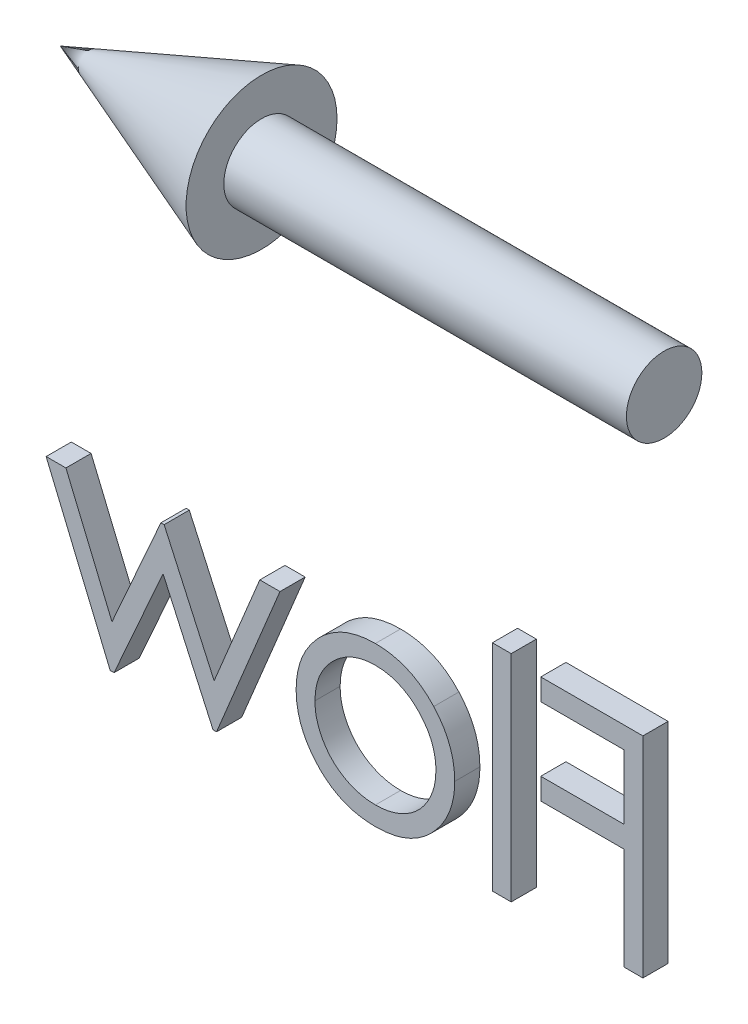
from build123d import *

# Parameters (mm, degrees)
BOSS_EXTRUDE1_DEPTH   = 3.175
BOSS_EXTRUDE1_2_DEPTH = 3.175
SKETCH2_W             = 4.748931624
SKETCH2_H             = 54.273504274
BOSS_EXTRUDE1_3_DEPTH = 3.175
BOSS_EXTRUDE1_4_DEPTH = 3.175


with BuildPart() as part:
    # Sketch1 → Revolve1 (revolve)
    with BuildSketch(Plane(origin=(0, 0, 0), x_dir=(1, 0, 0), z_dir=(0, 1, 0))):
        Polygon((0, 0), (0, 9.525), (-101.6, 9.525), (-101.6, 19.05), (-152.4, 0), align=None)
    revolve(axis=Axis((0, 0, 0), (-1, 0, 0)))


with BuildPart() as body_2:
    # Sketch2 → Boss-Extrude1 (new, symmetric)
    with BuildSketch(Plane.XY):
        Polygon((-93.766213925, -88.330128205), (-98.864955245, -88.330128205), (-110.387474609, -116.145299145), (-123.012424529, -88.330128205), (-123.818046858, -88.330128205), (-136.167389139, -116.145299145), (-147.795911441, -88.330128205), (-152.788649822, -88.330128205), (-136.623201772, -127), (-135.637374449, -127), (-123.277431874, -99.18482906), (-110.663082248, -127), (-109.783257862, -127), align=None)
    extrude(amount=BOSS_EXTRUDE1_DEPTH, both=True)


with BuildPart() as body_3:
    # Sketch2 → Boss-Extrude1 2 (new, symmetric)
    with BuildSketch(Plane.XY):
        with BuildLine():
            add(Edge.make_bspline(
                [(-69.703546991, -87.651709402), (-70.429129331, -87.667159422), (-71.851818975, -87.697453137), (-73.935342964, -88.021227023), (-75.924180138, -88.516335984), (-77.825947567, -89.200798887), (-79.616289177, -90.118252187), (-81.321282987, -91.213011708), (-82.936254431, -92.509962825), (-83.904221659, -93.51323362), (-84.395554203, -94.022485978)],
                knots=[0, 0, 0, 0, 1.054011418, 2.066658804, 3.057071809, 4.030435133, 4.997543892, 5.974964718, 6.972108034, 8, 8, 8, 8], degree=3))
            add(Edge.make_bspline(
                [(-84.395554203, -94.022485978), (-84.818614699, -94.509530763), (-85.656548305, -95.474194675), (-86.730994291, -97.038345014), (-87.656605975, -98.658201296), (-88.398391218, -100.355273973), (-88.983271933, -102.114748168), (-89.398527103, -103.942671432), (-89.645526, -105.835006919), (-89.678832762, -107.120183995), (-89.695701105, -107.771067041)],
                knots=[0, 0, 0, 0, 1.025258237, 2.030674902, 3.01204498, 3.988269485, 4.97094183, 5.956517959, 6.965070386, 8, 8, 8, 8], degree=3))
            add(Edge.make_bspline(
                [(-89.695701105, -107.771067041), (-89.680864219, -108.425722675), (-89.651545841, -109.719352738), (-89.374207831, -111.62464553), (-88.942844985, -113.472114873), (-88.325506479, -115.254026076), (-87.533901732, -116.975825967), (-86.567935385, -118.629994153), (-85.420828792, -120.219794263), (-84.12053027, -121.731726817), (-82.683436428, -123.125192208), (-81.124418471, -124.33967914), (-79.474113437, -125.380195044), (-77.710577025, -126.218340852), (-75.849913831, -126.879189892), (-73.888110539, -127.343344903), (-71.828214833, -127.623979883), (-70.421731844, -127.660017241), (-69.703546991, -127.678418803)],
                knots=[0, 0, 0, 0, 0.998656419, 1.973391657, 2.932242238, 3.890759089, 4.846373663, 5.82037756, 6.809684879, 7.83454468, 8.860553229, 9.859544525, 10.845671541, 11.83227036, 12.833544569, 13.85385346, 14.904124723, 16, 16, 16, 16], degree=3))
            add(Edge.make_bspline(
                [(-69.703546991, -127.678418803), (-68.981843494, -127.65995548), (-67.568350734, -127.623794127), (-65.501184102, -127.34443521), (-63.535864864, -126.879403807), (-61.672765815, -126.216169095), (-59.901647295, -125.380168255), (-58.24178002, -124.342824853), (-56.681495583, -123.12483203), (-55.244097723, -121.73182441), (-53.943880714, -120.219769118), (-52.796753088, -118.630000679), (-51.830792205, -116.975824266), (-51.039186027, -115.25402653), (-50.421847903, -113.472114752), (-49.990484954, -111.624645563), (-49.713146972, -109.719352729), (-49.68382859, -108.425722672), (-49.668991703, -107.771067041)],
                knots=[0, 0, 0, 0, 1.099876186, 2.154163076, 3.173186993, 4.173200201, 5.163417411, 6.152872554, 7.150605724, 8.17532212, 9.198891216, 10.186952605, 11.159729845, 12.11414092, 13.071450619, 14.029093627, 15.002601286, 16, 16, 16, 16], degree=3))
            add(Edge.make_bspline(
                [(-49.668991703, -107.771067041), (-49.685975086, -107.123721644), (-49.719599265, -105.842089013), (-49.966349818, -103.953310834), (-50.379985137, -102.128481261), (-50.965566964, -100.375798469), (-51.714189493, -98.68616271), (-52.62679468, -97.062303956), (-53.712200672, -95.505226496), (-54.546801606, -94.541809334), (-54.969138605, -94.054286859)],
                knots=[0, 0, 0, 0, 1.031353054, 2.041901799, 3.029428768, 4.008703097, 4.981709435, 5.96992636, 6.972712378, 8, 8, 8, 8], degree=3))
            add(Edge.make_bspline(
                [(-54.969138605, -94.054286859), (-55.459730397, -93.540618135), (-56.424565482, -92.530398204), (-58.047576008, -91.237227899), (-59.748375446, -90.119687259), (-61.558502306, -89.220463525), (-63.45870742, -88.512309745), (-65.457736444, -88.019950171), (-67.548330547, -87.698619685), (-68.977981961, -87.667501997), (-69.703546991, -87.651709402)],
                knots=[0, 0, 0, 0, 1.027980169, 2.021703884, 2.998553061, 3.971491411, 4.943284454, 5.930300938, 6.949603206, 8, 8, 8, 8], degree=3))
        make_face()
        with BuildLine():
            add(Edge.make_bspline(
                [(-69.682346404, -92.400641026), (-69.169242042, -92.415224733), (-68.156279025, -92.444015672), (-66.665244828, -92.662998517), (-65.22984012, -93.009942924), (-63.847341643, -93.502885203), (-62.522411536, -94.13938046), (-61.253781286, -94.92116162), (-60.037719396, -95.837874177), (-58.898014391, -96.888083617), (-57.852043719, -98.035301748), (-56.937674311, -99.257651936), (-56.160175679, -100.53530741), (-55.512473276, -101.869596792), (-55.03006698, -103.274041622), (-54.679712949, -104.732736879), (-54.460936695, -106.248654486), (-54.432416447, -107.279184167), (-54.417923327, -107.802867922)],
                knots=[0, 0, 0, 0, 1.021534396, 2.016698045, 2.994645724, 3.958388632, 4.93408049, 5.916473867, 6.921342795, 7.962252576, 8.998418191, 10.008913653, 10.997312074, 11.973003931, 12.956656626, 13.948281152, 14.957379055, 16, 16, 16, 16], degree=3))
            add(Edge.make_bspline(
                [(-54.417923327, -107.802867922), (-54.44221697, -108.479475952), (-54.490435309, -109.822416368), (-54.882551383, -111.800155961), (-55.538510615, -113.698833963), (-56.424294487, -115.5073198), (-57.534126602, -117.180579241), (-58.841728682, -118.672398112), (-60.333067009, -119.960326452), (-61.990364095, -121.028953521), (-63.779768663, -121.878035542), (-65.673524947, -122.479758151), (-67.648687821, -122.8709135), (-68.998527447, -122.909791744), (-69.682346404, -122.929487179)],
                knots=[0, 0, 0, 0, 1.016792936, 2.018143844, 3.017858371, 4.030088057, 5.03801393, 6.028138512, 7.003788237, 7.991172063, 8.984598303, 9.972568034, 10.972917682, 12, 12, 12, 12], degree=3))
            add(Edge.make_bspline(
                [(-69.682346404, -122.929487179), (-70.366126029, -122.90967699), (-71.715888016, -122.870572225), (-73.688306523, -122.481728165), (-75.576886812, -121.875399009), (-77.36443279, -121.029908455), (-79.020975485, -119.956268375), (-80.523039581, -118.679670769), (-81.819476916, -117.176628017), (-82.92821118, -115.505103474), (-83.828501219, -113.701637674), (-84.481390103, -111.799805533), (-84.874448842, -109.822505614), (-84.922539943, -108.479505852), (-84.946769481, -107.802867922)],
                knots=[0, 0, 0, 0, 1.02726834, 2.027799167, 3.010890988, 4.004497153, 4.992059811, 5.971914811, 6.958719428, 7.966827853, 8.981595046, 9.981490638, 10.983022906, 12, 12, 12, 12], degree=3))
            add(Edge.make_bspline(
                [(-84.946769481, -107.802867922), (-84.93228135, -107.279181038), (-84.903770922, -106.248645197), (-84.684923246, -104.732772387), (-84.33483354, -103.273911343), (-83.851453136, -101.870077484), (-83.206565069, -100.531852716), (-82.414073079, -99.261403271), (-81.503437337, -98.031067396), (-80.444845152, -96.891792113), (-79.306329796, -95.837464774), (-78.089775052, -94.920806149), (-76.823025972, -94.142816312), (-75.501945019, -93.497441008), (-74.119269294, -93.014427648), (-72.685875794, -92.660995244), (-71.20120331, -92.44494108), (-70.191870157, -92.415502156), (-69.682346404, -92.400641026)],
                knots=[0, 0, 0, 0, 1.042956736, 2.052379634, 3.044323526, 4.02829302, 5.004299113, 5.996692471, 7.007513377, 8.048758398, 9.090003419, 10.095195979, 11.07790575, 12.047570684, 13.018257071, 13.989683339, 14.985167495, 16, 16, 16, 16], degree=3))
        make_face(mode=Mode.SUBTRACT)
    extrude(amount=BOSS_EXTRUDE1_2_DEPTH, both=True)


with BuildPart() as body_4:
    # Sketch2 → Boss-Extrude1 3 (new, symmetric)
    with BuildSketch(Plane.XY):
        with Locations((-37.796662643, -99.863247863)):
            Rectangle(SKETCH2_W, SKETCH2_H)
    extrude(amount=BOSS_EXTRUDE1_3_DEPTH, both=True)


with BuildPart() as body_5:
    # Sketch2 → Boss-Extrude1 4 (new, symmetric)
    with BuildSketch(Plane.XY):
        Polygon((-2.179675464, -74.083333333), (-27.959589993, -74.083333333), (-27.959589993, -79.510683761), (-6.928607087, -79.510683761), (-6.928607087, -95.792735043), (-27.959589993, -95.792735043), (-27.959589993, -101.22008547), (-6.928607087, -101.22008547), (-6.928607087, -127), (-2.179675464, -127), align=None)
    extrude(amount=BOSS_EXTRUDE1_4_DEPTH, both=True)


solid = Compound([part.part, body_2.part, body_3.part, body_4.part, body_5.part])
